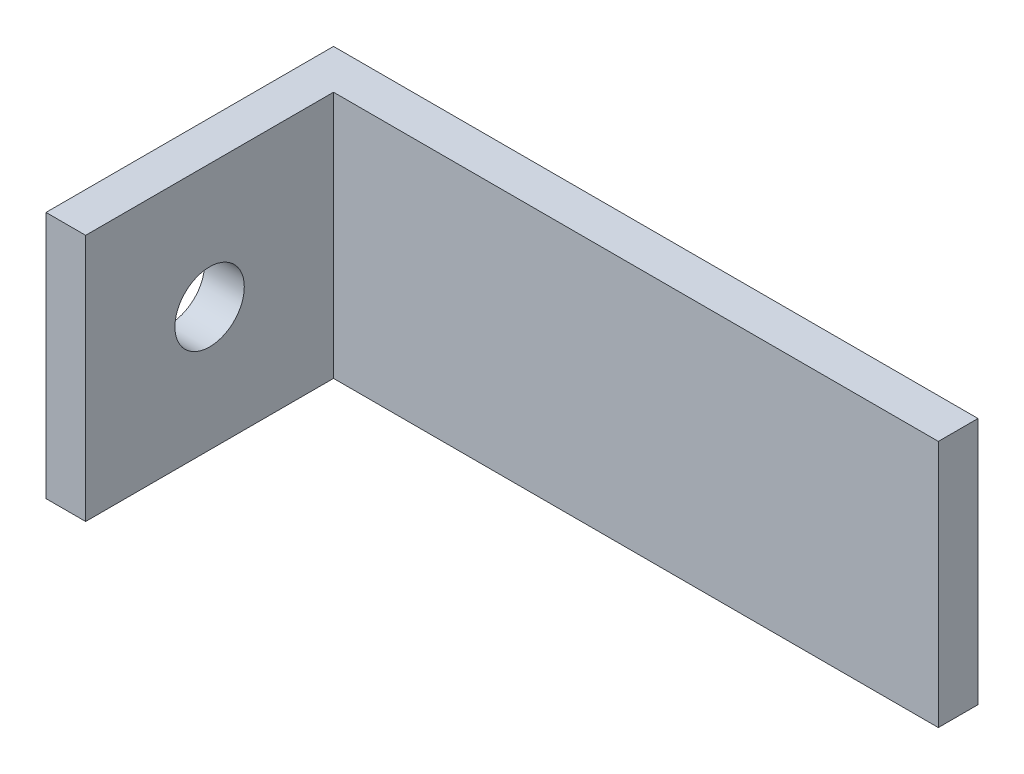
from build123d import *

# Parameters (mm, degrees)
SKETCH1_W                = 57.8
SKETCH1_H                = 24.4
BOSS_EXTRUDE1_DEPTH      = 2
SKETCH2_W                = 4
SKETCH2_H                = 24.4
BOSS_EXTRUDE2_DEPTH      = 24.4
SKETCH3_R                = 3
CUT_EXTRUDE1_DEPTH       = 78.293389523
SKETCH4_R                = 1.5
CUT_EXTRUDE2_DEPTH       = 91.459620286
SKETCH5_W                = 57.8
SKETCH5_H                = 24.4
BOSS_EXTRUDE3_DEPTH      = 2
SKETCH6_R                = 1.5
CUT_EXTRUDE3_DEPTH       = 13
SKETCH8_W                = 4
SKETCH8_H                = 24.4
BOSS_EXTRUDE4_DEPTH      = 25
BOSS_EXTRUDE5_DEPTH      = 25
SKETCH10_R               = 1.5
CUT_EXTRUDE4_DEPTH       = 91.623302203
SKETCH11_R               = 3.5
CUT_EXTRUDE5_DEPTH       = 78.500374605
BOSS_EXTRUDE6_DEPTH      = 61
BOSS_EXTRUDE6_DEPTH_BACK = 4
SKETCH14_W               = 4
SKETCH14_H               = 25


with BuildPart() as part:
    # Sketch1 → Boss-Extrude1 (new body)
    with BuildSketch(Plane.XY):
        with Locations((-43.243709624, -36.61462961)):
            Rectangle(SKETCH1_W, SKETCH1_H)
    extrude(amount=BOSS_EXTRUDE1_DEPTH)

    # Sketch2 → Boss-Extrude2 (add)
    with BuildSketch(Plane.XY.offset(2)):
        with Locations((-70.143709624, -36.61462961)):
            Rectangle(SKETCH2_W, SKETCH2_H)
    extrude(amount=BOSS_EXTRUDE2_DEPTH)

    # Sketch3 → Cut-Extrude1 (cut, through all)
    with BuildSketch(Plane(origin=(-68.143709624, 0, 0), x_dir=(0, 0, -1), z_dir=(1, 0, 0))):
        with Locations((-14.2, -36.61462961)):
            Circle(SKETCH3_R)
    extrude(amount=-CUT_EXTRUDE1_DEPTH, mode=Mode.SUBTRACT)

    # Sketch4 → Cut-Extrude2 (cut, through all)
    with BuildSketch(Plane.XY.offset(2)):
        with Locations((-60.143709624, -43.81462961)):
            Circle(SKETCH4_R)
        with Locations((-20.143709624, -43.81462961)):
            Circle(SKETCH4_R)
        with Locations((-20.143709624, -28.81462961)):
            Circle(SKETCH4_R)
        with Locations((-60.143709624, -28.81462961)):
            Circle(SKETCH4_R)
    extrude(amount=-CUT_EXTRUDE2_DEPTH, mode=Mode.SUBTRACT)

    # Sketch5 → Boss-Extrude3 (add)
    with BuildSketch(Plane(origin=(0, 0, 0), x_dir=(-1, 0, 0), z_dir=(0, 0, -1))):
        with Locations((43.243709624, -36.61462961)):
            Rectangle(SKETCH5_W, SKETCH5_H)
    extrude(amount=BOSS_EXTRUDE3_DEPTH)

    # Sketch6 → Cut-Extrude3 (cut)
    with BuildSketch(Plane.XY):
        with Locations((-60.143709624, -28.81462961)):
            Circle(SKETCH6_R)
        with Locations((-20.143709624, -28.81462961)):
            Circle(SKETCH6_R)
        with Locations((-20.143709624, -43.81462961)):
            Circle(SKETCH6_R)
        with Locations((-60.143709624, -43.81462961)):
            Circle(SKETCH6_R)
    extrude(amount=-CUT_EXTRUDE3_DEPTH, mode=Mode.SUBTRACT)

    # Sketch8 → Boss-Extrude4 (add)
    with BuildSketch(Plane.XY.offset(2)):
        with Locations((-70.143709624, -36.61462961)):
            Rectangle(SKETCH8_W, SKETCH8_H)
    extrude(amount=BOSS_EXTRUDE4_DEPTH)

    # Sketch9 → Boss-Extrude5 (add)
    with BuildSketch(Plane(origin=(0, -48.81462961, 0), x_dir=(-1, 0, 0), z_dir=(0, -1, 0))):
        Polygon((72.143709624, -27), (68.143709624, -27), (68.143709624, -2), (14.343709624, -2), (14.343709624, 2), (72.143709624, 2), align=None)
    extrude(amount=-BOSS_EXTRUDE5_DEPTH)

    # Sketch10 → Cut-Extrude4 (cut, through all)
    with BuildSketch(Plane.XY.offset(2)):
        with Locations((-58.143709624, -28.81462961)):
            Circle(SKETCH10_R)
        with Locations((-28.143709624, -28.81462961)):
            Circle(SKETCH10_R)
        with Locations((-28.143709624, -43.81462961)):
            Circle(SKETCH10_R)
        with Locations((-58.143709624, -43.81462961)):
            Circle(SKETCH10_R)
    extrude(amount=-CUT_EXTRUDE4_DEPTH, mode=Mode.SUBTRACT)

    # Sketch11 → Cut-Extrude5 (cut, through all)
    with BuildSketch(Plane(origin=(-68.143709624, 0, 0), x_dir=(0, 0, -1), z_dir=(1, 0, 0))):
        with Locations((-14.5, -36.31462961)):
            Circle(SKETCH11_R)
    extrude(amount=-CUT_EXTRUDE5_DEPTH, mode=Mode.SUBTRACT)

    # Sketch14 → Boss-Extrude6 (add, two sides: drawn at the far end of the back side and taken through both)
    with BuildSketch(Plane(origin=(-68.143709624, 0, 0), x_dir=(0, 0, -1), z_dir=(1, 0, 0)).offset(-BOSS_EXTRUDE6_DEPTH_BACK)):
        with Locations((0, -36.31462961)):
            Rectangle(SKETCH14_W, SKETCH14_H)
    extrude(amount=BOSS_EXTRUDE6_DEPTH + BOSS_EXTRUDE6_DEPTH_BACK)


solid = part.part
